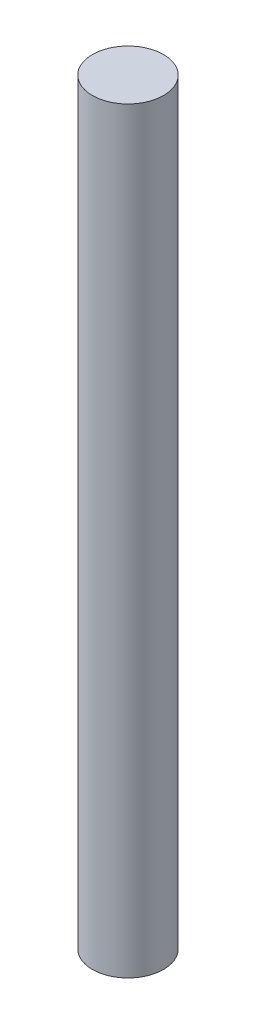
from build123d import *

# Parameters (mm, degrees)
SKETCH1_R           = 10
BOSS_EXTRUDE1_DEPTH = 213


with BuildPart() as part:
    # Sketch1 → Boss-Extrude1 (new body)
    with BuildSketch(Plane(origin=(0, 0, 0), x_dir=(1, 0, 0), z_dir=(0, 1, 0))):
        with Locations(Location((0, 0, 0), (0, 0, 270))):
            Circle(SKETCH1_R)
    extrude(amount=BOSS_EXTRUDE1_DEPTH)


solid = part.part
